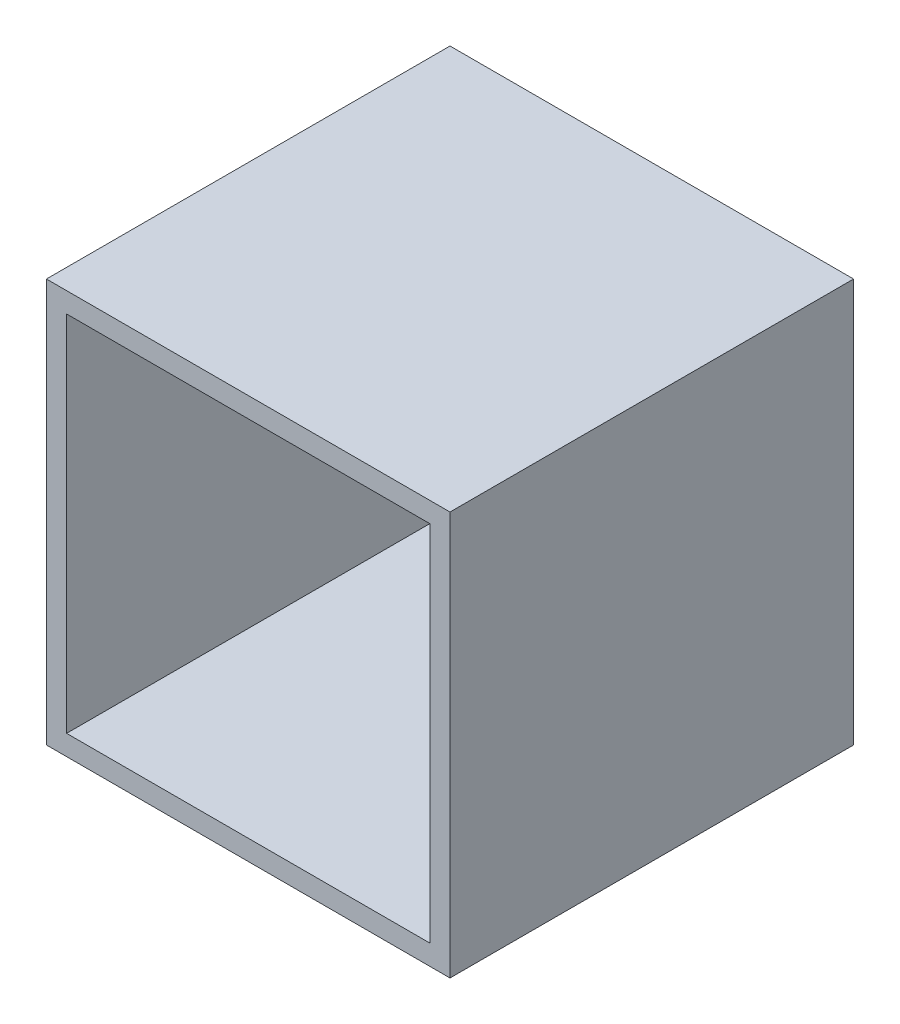
from build123d import *

# Parameters (mm, degrees)
SKETCH2_W           = 100
SKETCH2_H           = 100
BOSS_EXTRUDE1_DEPTH = 100
SHELL2_T            = -5


with BuildPart() as part:
    # Sketch2 → Boss-Extrude1 (new body)
    with BuildSketch(Plane.XY):
        with Locations((1.868686869, -22.727272727)):
            Rectangle(SKETCH2_W, SKETCH2_H)
    extrude(amount=BOSS_EXTRUDE1_DEPTH)

    # Shell2
    shell2_openings = [part.faces().sort_by_distance(p)[0] for p in [
        (1.868686869, -22.727272727, 100),
    ]]
    offset(amount=SHELL2_T, openings=shell2_openings, kind=Kind.INTERSECTION)


solid = part.part
